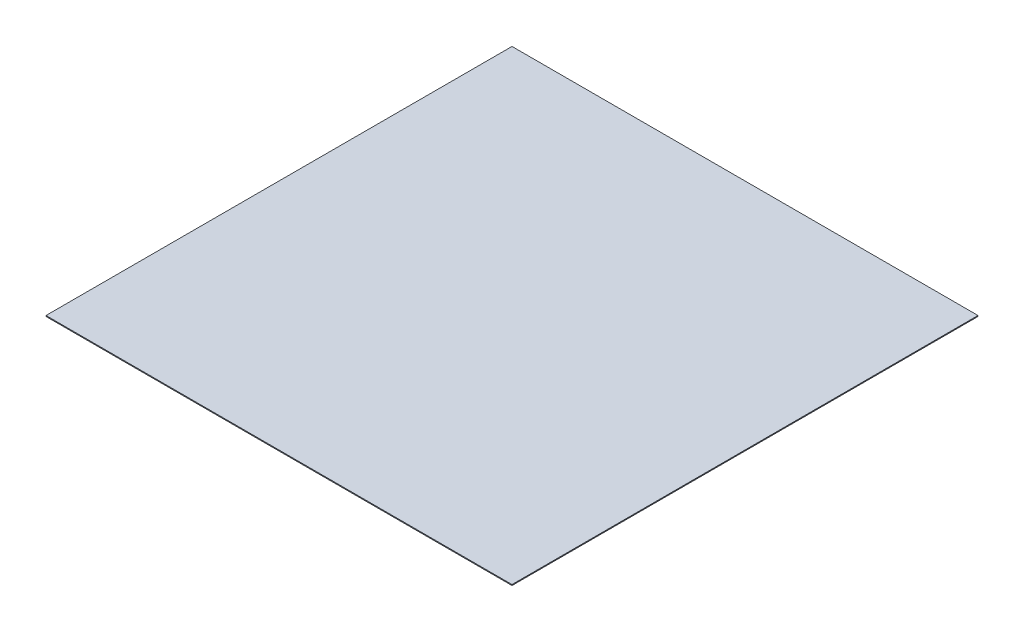
from build123d import *

# Parameters (mm, degrees)
SKETCH1_W           = 52
SKETCH1_H           = 52
BOSS_EXTRUDE1_DEPTH = 0.1


with BuildPart() as part:
    # Sketch1 → Boss-Extrude1 (new body)
    with BuildSketch(Plane(origin=(0, 0, 0), x_dir=(1, 0, 0), z_dir=(0, 1, 0))):
        Rectangle(SKETCH1_W, SKETCH1_H)
    extrude(amount=BOSS_EXTRUDE1_DEPTH)


solid = part.part
